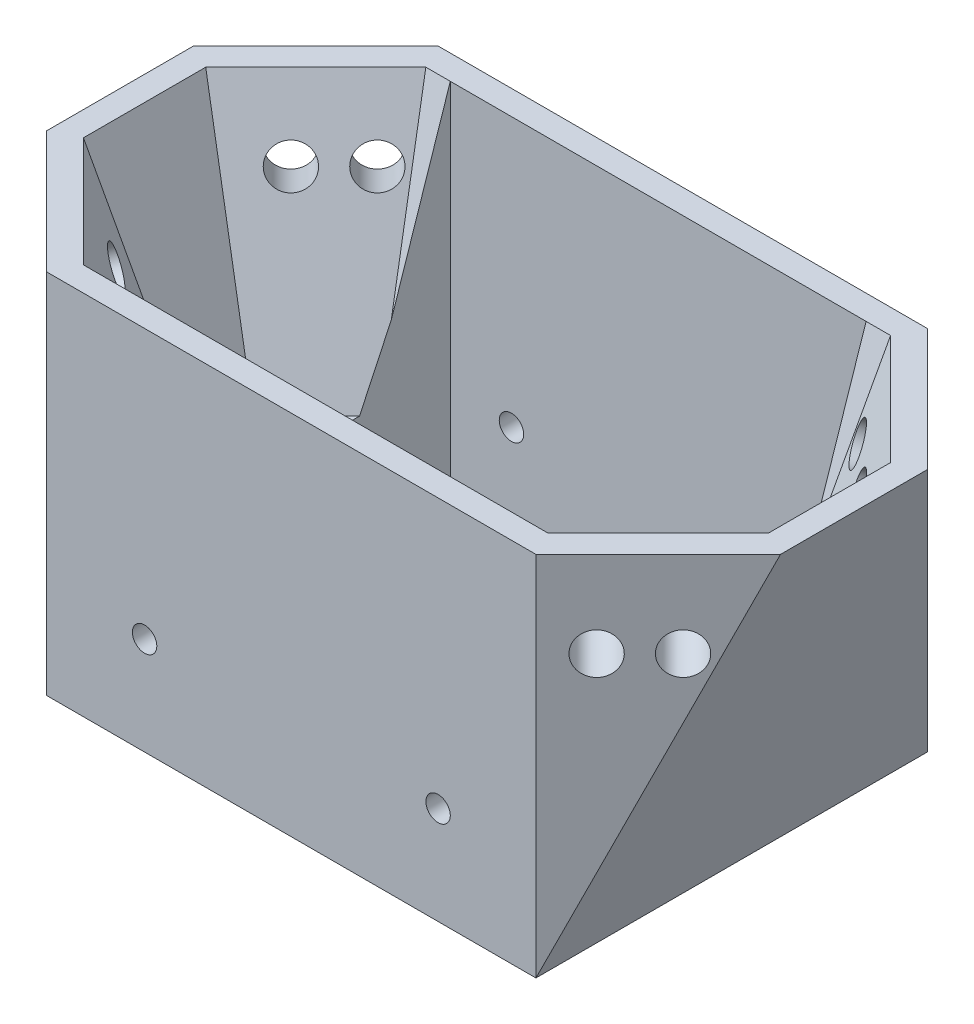
from build123d import *

# Parameters (mm, degrees)
BOSS_EXTRUDE1_DEPTH                        = 150
CUT_EXTRUDE1_DEPTH                         = 227.715680975
CUT_EXTRUDE1_DEPTH_BACK                    = 227.715680975
SKETCH3_W                                  = 170
SKETCH3_H                                  = 190
CUT_EXTRUDE2_DEPTH                         = 70
CUT_EXTRUDE3_DEPTH                         = 100
CUT_EXTRUDE3_DRAFT                         = -18.43
SKETCH7_R                                  = 5
CUT_EXTRUDE5_DEPTH                         = 266.706605112
SKETCH9_W                                  = 10
SKETCH9_H                                  = 3
SKETCH9_W_2                                = 5
SKETCH9_H_2                                = 15
BOSS_EXTRUDE2_DEPTH                        = 15
SKETCH10_R                                 = 8
CUT_EXTRUDE6_DEPTH                         = 40
MIRROR1_AT_THE_SECOND_PLANE_COPY_1_SKETC_R = 8
MIRROR1_AT_THE_SECOND_PLANE_COPY_1_DEPTH   = 40


with BuildPart() as part:
    # Sketch1 → Boss-Extrude1 (new body)
    with BuildSketch(Plane(origin=(0, 0, 0), x_dir=(1, 0, 0), z_dir=(0, 1, 0))):
        Polygon((-150, 30), (-100, 80), (100, 80), (150, 30), (150, -30), (100, -80), (-100, -80), (-150, -30), align=None)
    extrude(amount=BOSS_EXTRUDE1_DEPTH)

    # Sketch2 → Cut-Extrude1 (cut, two sides: drawn at the far end of the back side and taken through both)
    with BuildSketch(Plane.XY.offset(-CUT_EXTRUDE1_DEPTH_BACK)):
        Polygon((-150, 150), (-100, 0), (-150, 0), align=None)
        Polygon((100, 0), (150, 150), (150, 0), align=None)
    extrude(amount=CUT_EXTRUDE1_DEPTH + CUT_EXTRUDE1_DEPTH_BACK, mode=Mode.SUBTRACT)

    # Sketch3 → Cut-Extrude2 (cut, symmetric)
    with BuildSketch(Plane.XY):
        with Locations((0, 105)):
            Rectangle(SKETCH3_W, SKETCH3_H)
    extrude(amount=CUT_EXTRUDE2_DEPTH, both=True, mode=Mode.SUBTRACT)


with BuildPart() as cut_extrude3_tool:
    # Sketch4 → Cut-Extrude3 (with draft: the straight prism first)
    with BuildSketch(Plane(origin=(0, 150, 0), x_dir=(1, 0, 0), z_dir=(0, 1, 0))):
        Polygon((-140, -25), (-125, -40), (-95, -70), (95, -70), (140, -25), (140, 25), (95, 70), (-95, 70), (-140, 25), align=None)
    extrude(amount=-CUT_EXTRUDE3_DEPTH)
    # Cut-Extrude3: the draft: its side faces are tilted about the plane it starts from
    cut_extrude3_sides = [cut_extrude3_tool.faces().sort_by_distance(p)[0] for p in [
        (-117.5, 100, 47.5),
        (-117.5, 100, -47.5),
        (0, 100, -70),
        (117.5, 100, -47.5),
        (140, 100, 0),
        (117.5, 100, 47.5),
        (0, 100, 70),
        (-140, 100, 0),
    ]]
    draft(cut_extrude3_sides, Plane(origin=(0, 150, 0), x_dir=(1, 0, 0), z_dir=(0, 1, 0)), CUT_EXTRUDE3_DRAFT)


with BuildPart() as part_1:
    add(part.part)

    # Cut-Extrude3: cut by cut_extrude3_tool
    add(cut_extrude3_tool.part, mode=Mode.SUBTRACT)

    # Sketch7 → Cut-Extrude5 (cut, through all)
    with BuildSketch(Plane.XY.offset(80)):
        with Locations((-60, 40)):
            Circle(SKETCH7_R)
        with Locations((60, 40)):
            Circle(SKETCH7_R)
    extrude(amount=-CUT_EXTRUDE5_DEPTH, mode=Mode.SUBTRACT)

    # Sketch9 → Boss-Extrude2 (add)
    with BuildSketch(Plane(origin=(0, 10, 0), x_dir=(1, 0, 0), z_dir=(0, 1, 0))):
        with Locations((70, 3.5)):
            Rectangle(SKETCH9_W, SKETCH9_H)
        with Locations((-22.5, -42.5)):
            Rectangle(SKETCH9_W_2, SKETCH9_H_2)
    extrude(amount=BOSS_EXTRUDE2_DEPTH)

    # Sketch10 → Cut-Extrude6 (cut)
    with BuildSketch(Plane(origin=(-42.441799319, -20.001495929, 42.441799319), x_dir=(-0.6068291050905237, -0.2859796255102719, -0.7416023806650293), z_dir=(0.670839704394397, 0.31614582397380653, -0.6708397043943964))):
        with Locations(Location((-14.755059332, 151.805613608, 0), (0, 0, 17.544132392))):
            Circle(SKETCH10_R)
        with Locations(Location((9.082066856, 159.341621508, 0), (0, 0, 17.544132392))):
            Circle(SKETCH10_R)
    cut_extrude6 = extrude(amount=-CUT_EXTRUDE6_DEPTH, mode=Mode.SUBTRACT)

    # Mirror1: Cut-Extrude6 across plane
    add(cut_extrude6.mirror(Plane(origin=(0, 0, 0), x_dir=(0, 0, 1), z_dir=(1, 0, 0))), mode=Mode.SUBTRACT)

    # Mirror1 at the second plane: Cut-Extrude6 across plane
    add(cut_extrude6.mirror(Plane.XY), mode=Mode.SUBTRACT)

    # Mirror1 at the second plane copy 1 sketc → Mirror1 at the second plane copy 1 (cut)
    with BuildSketch(Plane(origin=(42.441799319, -20.001495929, -42.441799319), x_dir=(0.6068291050905237, -0.2859796255102719, 0.7416023806650293), z_dir=(-0.670839704394397, 0.31614582397380653, 0.6708397043943964))):
        with Locations(Location((-14.755059332, 151.805613608, 0), (0, 0, 17.544132392))):
            Circle(MIRROR1_AT_THE_SECOND_PLANE_COPY_1_SKETC_R)
        with Locations(Location((9.082066856, 159.341621508, 0), (0, 0, 17.544132392))):
            Circle(MIRROR1_AT_THE_SECOND_PLANE_COPY_1_SKETC_R)
    extrude(amount=-MIRROR1_AT_THE_SECOND_PLANE_COPY_1_DEPTH, mode=Mode.SUBTRACT)


solid = part_1.part
